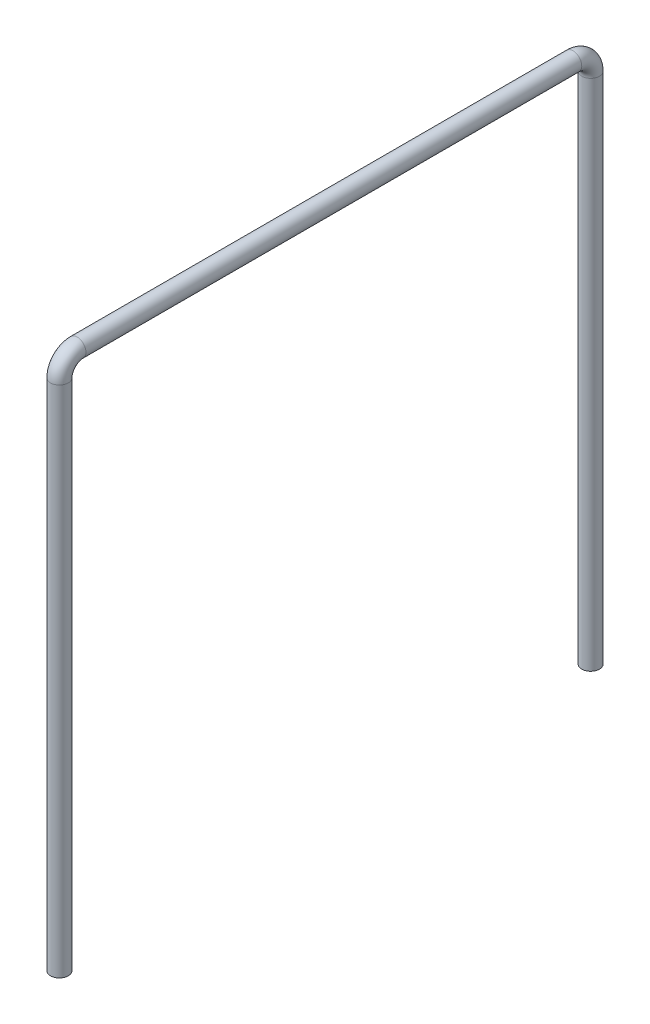
from build123d import *

# Parameters (mm, degrees)
ESQUISSE1_R = 5


with BuildPart() as part:
    # Balayage1: sweep along a path in Esquisse2
    with BuildLine(Plane(origin=(0, 0, 0), x_dir=(0, 0, -1), z_dir=(1, 0, 0))) as balayage1_path:
        Line((-150, -300), (-150, -10))
        ThreePointArc((-150, -10), (-147.071067812, -2.928932188), (-140, 0))
        Line((-140, 0), (140, 0))
        ThreePointArc((140, 0), (147.071067812, -2.928932188), (150, -10))
        Line((150, -10), (150, -300))
    # Esquisse1 → Balayage1 (sweep)
    with BuildSketch(Plane.XY):
        Circle(ESQUISSE1_R)
    sweep(path=balayage1_path.line)


solid = part.part
